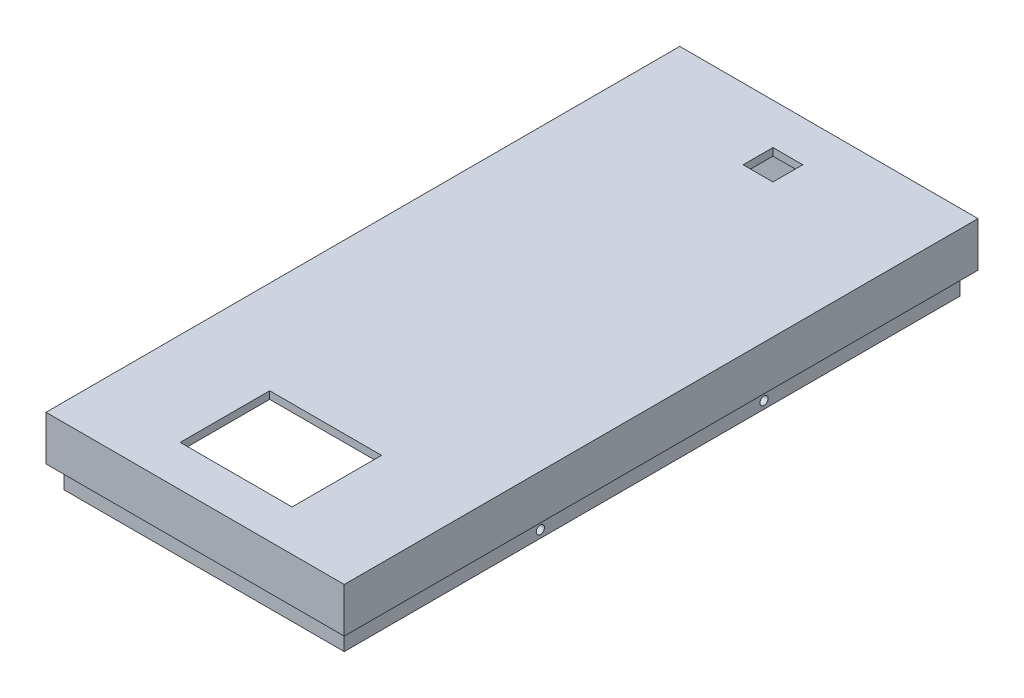
from build123d import *

# Parameters (mm, degrees)
BOSS_EXTRUDE1_START = -85
SKETCH1_W           = 80
SKETCH1_H           = 12
BOSS_EXTRUDE1_DEPTH = 170
BOSS_EXTRUDE2_START = -83
SKETCH2_W           = 76
SKETCH2_H           = 14
BOSS_EXTRUDE2_DEPTH = 166
BOSS_EXTRUDE3_START = -82.6
SKETCH3_W           = 75.2
SKETCH3_H           = 16.5
BOSS_EXTRUDE3_DEPTH = 165.2
BOSS_EXTRUDE4_START = -80.6
SKETCH4_W           = 71.2
SKETCH4_H           = 17
BOSS_EXTRUDE4_DEPTH = 161.2
BOSS_EXTRUDE5_START = 50
SKETCH5_W           = 30
SKETCH5_H           = 10
BOSS_EXTRUDE5_DEPTH = 24
BOSS_EXTRUDE6_START = -74
SKETCH6_W           = 8
SKETCH6_H           = 10
BOSS_EXTRUDE6_DEPTH = 8
BOSS_EXTRUDE7_START = -45
SKETCH7_R           = 1.1
BOSS_EXTRUDE7_DEPTH = 90
BOSS_EXTRUDE8_START = -45
SKETCH8_R           = 1.1
BOSS_EXTRUDE8_DEPTH = 90


with BuildPart() as part:
    # Sketch1 → Boss-Extrude1 (new body)
    with BuildSketch(Plane.XY.offset(BOSS_EXTRUDE1_START)):
        with Locations((0, 40)):
            Rectangle(SKETCH1_W, SKETCH1_H)
    extrude(amount=BOSS_EXTRUDE1_DEPTH)


with BuildPart() as body_2:
    # Sketch2 → Boss-Extrude2 (new body)
    with BuildSketch(Plane.XY.offset(BOSS_EXTRUDE2_START)):
        with Locations((0, 37)):
            Rectangle(SKETCH2_W, SKETCH2_H)
    extrude(amount=BOSS_EXTRUDE2_DEPTH)


with BuildPart() as part_1:
    add(part.part)

    # Combine1: cut body 2
    add(body_2.part, mode=Mode.SUBTRACT)

    # Sketch3 → Boss-Extrude3 (add)
    with BuildSketch(Plane.XY.offset(BOSS_EXTRUDE3_START)):
        with Locations((0, 36.25)):
            Rectangle(SKETCH3_W, SKETCH3_H)
    extrude(amount=BOSS_EXTRUDE3_DEPTH)


with BuildPart() as body_2_2:
    # Sketch4 → Boss-Extrude4 (new body)
    with BuildSketch(Plane.XY.offset(BOSS_EXTRUDE4_START)):
        with Locations((0, 35.5)):
            Rectangle(SKETCH4_W, SKETCH4_H)
    extrude(amount=BOSS_EXTRUDE4_DEPTH)


with BuildPart() as part_2:
    add(part_1.part)

    # Combine2: cut body 2 2
    add(body_2_2.part, mode=Mode.SUBTRACT)


with BuildPart() as body_2_3:
    # Sketch5 → Boss-Extrude5 (new body)
    with BuildSketch(Plane.XY.offset(BOSS_EXTRUDE5_START)):
        with Locations((0, 45)):
            Rectangle(SKETCH5_W, SKETCH5_H)
    extrude(amount=BOSS_EXTRUDE5_DEPTH)


with BuildPart() as part_3:
    add(part_2.part)

    # Combine3: cut body 2 3
    add(body_2_3.part, mode=Mode.SUBTRACT)


with BuildPart() as body_2_4:
    # Sketch6 → Boss-Extrude6 (new body)
    with BuildSketch(Plane.XY.offset(BOSS_EXTRUDE6_START)):
        with Locations((0, 45)):
            Rectangle(SKETCH6_W, SKETCH6_H)
    extrude(amount=BOSS_EXTRUDE6_DEPTH)


with BuildPart() as part_4:
    add(part_3.part)

    # Combine4: cut body 2 4
    add(body_2_4.part, mode=Mode.SUBTRACT)


with BuildPart() as body_2_5:
    # Sketch7 → Boss-Extrude7 (new body)
    with BuildSketch(Plane(origin=(0, 0, 0), x_dir=(0, 0, -1), z_dir=(1, 0, 0)).offset(BOSS_EXTRUDE7_START)):
        with Locations((30, 30)):
            Circle(SKETCH7_R)
    extrude(amount=BOSS_EXTRUDE7_DEPTH)


with BuildPart() as part_5:
    add(part_4.part)

    # Combine5: cut body 2 5
    add(body_2_5.part, mode=Mode.SUBTRACT)


with BuildPart() as body_2_6:
    # Sketch8 → Boss-Extrude8 (new body)
    with BuildSketch(Plane(origin=(0, 0, 0), x_dir=(0, 0, -1), z_dir=(1, 0, 0)).offset(BOSS_EXTRUDE8_START)):
        with Locations((-30, 30)):
            Circle(SKETCH8_R)
    extrude(amount=BOSS_EXTRUDE8_DEPTH)


with BuildPart() as part_6:
    add(part_5.part)

    # Combine6: cut body 2 6
    add(body_2_6.part, mode=Mode.SUBTRACT)


solid = part_6.part
